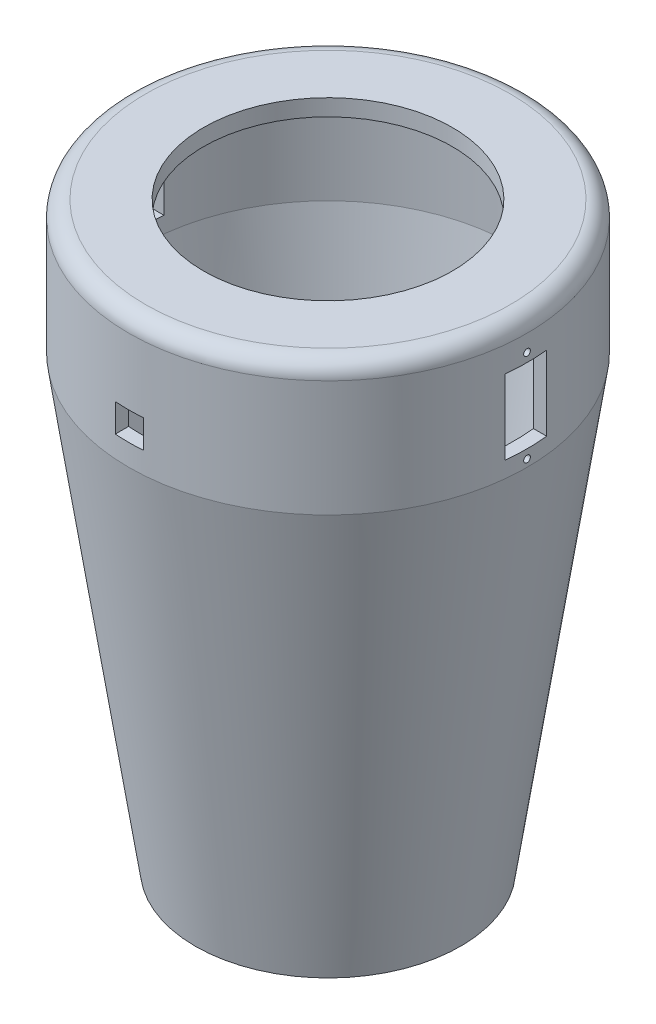
from build123d import *

# Parameters (mm, degrees)
SKETCH4_R               = 1
SKETCH4_W               = 12.5
SKETCH4_H               = 22.5
CUT_EXTRUDE2_DEPTH      = 217.564078277
CUT_EXTRUDE3_REACH      = 196.487
SKETCH5_R               = 37.5
FILLET1_R               = 5
CUT_EXTRUDE4_REACH      = 218.564
CUT_EXTRUDE4_END_RADIUS = 56
SKETCH6_W               = 8.5
SKETCH6_H               = 8.5


with BuildPart() as part:
    # Sketch2 → Revolve1 (revolve)
    with BuildSketch(Plane.XY, mode=Mode.PRIVATE) as revolve1_sk:
        Polygon((35, -5), (40, -5), (60, 130), (60, 170), (0, 170), (0, 165), (56, 165), (56, 130), align=None)
    revolve(revolve1_sk.sketch.rotate(Axis((0, 170, 0), (0, -1, 0)), 90), axis=Axis((0, 170, 0), (0, -1, 0)))

    # Sketch4 → Cut-Extrude2 (cut, through all)
    with BuildSketch(Plane(origin=(60, 0, 0), x_dir=(0, 0, -1), z_dir=(1, 0, 0))):
        with Locations((0, 132.2)):
            Circle(SKETCH4_R)
        with Locations((0, 160)):
            Circle(SKETCH4_R)
        with Locations((0, 146.1)):
            Rectangle(SKETCH4_W, SKETCH4_H)
    extrude(amount=-CUT_EXTRUDE2_DEPTH, mode=Mode.SUBTRACT)

    # Sketch5 → Cut-Extrude3 (cut, up to next)
    with BuildSketch(Plane(origin=(0, 170, 0), x_dir=(1, 0, 0), z_dir=(0, 1, 0)), mode=Mode.PRIVATE) as cut_extrude3_sk1:
        with Locations(Location((0, 0, 0), (0, 0, 270))):
            Circle(SKETCH5_R)
    cut_extrude3_tool1 = extrude(cut_extrude3_sk1.sketch, amount=-CUT_EXTRUDE3_REACH, mode=Mode.PRIVATE) & part.part
    add(cut_extrude3_tool1.solids().sort_by_distance((0, 170, 0))[0], mode=Mode.SUBTRACT)

    # Fillet1
    fillet1_edges = [part.edges().sort_by_distance(p)[0] for p in [
        (0, 170, -60),
    ]]
    fillet(fillet1_edges, radius=FILLET1_R)

    # Cut-Extrude4: up to this cylinder (the profile starts outside it)
    cut_extrude4_end = Plane(origin=(0, 140.75, 0), z_dir=(0, 1, 0)) * Cylinder(CUT_EXTRUDE4_END_RADIUS, 550.128, mode=Mode.PRIVATE)
    # Sketch6 → Cut-Extrude4 (cut, up to the surface)
    with BuildSketch(Plane.XY.offset(60), mode=Mode.PRIVATE) as cut_extrude4_sk1:
        with Locations((0, 140.75)):
            Rectangle(SKETCH6_W, SKETCH6_H)
    cut_extrude4_tool1 = extrude(cut_extrude4_sk1.sketch, amount=-CUT_EXTRUDE4_REACH, mode=Mode.PRIVATE) - cut_extrude4_end
    add(cut_extrude4_tool1.solids().sort_by_distance((0, 140.75, 60))[0], mode=Mode.SUBTRACT)


solid = part.part
